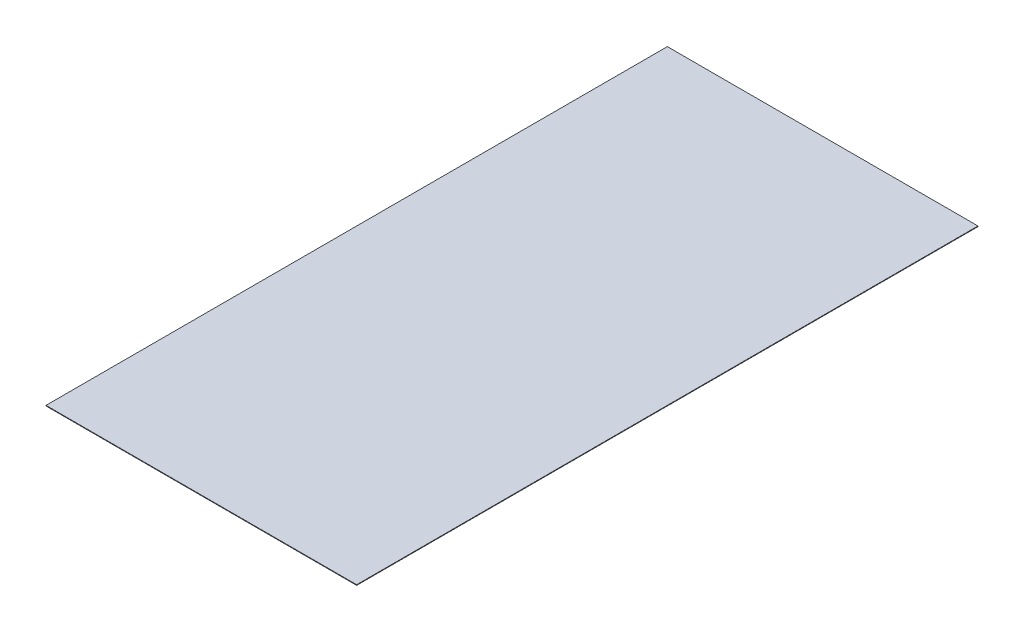
from build123d import *

# Parameters (mm, degrees)
CROQUIS1_W              = 1219.2
CROQUIS1_H              = 2438.4
SALIENTE_EXTRUIR1_DEPTH = 2.3


with BuildPart() as part:
    # Croquis1 → Saliente-Extruir1 (new body)
    with BuildSketch(Plane(origin=(0, 0, 0), x_dir=(1, 0, 0), z_dir=(0, 1, 0))):
        Rectangle(CROQUIS1_W, CROQUIS1_H)
    extrude(amount=SALIENTE_EXTRUIR1_DEPTH)


solid = part.part
